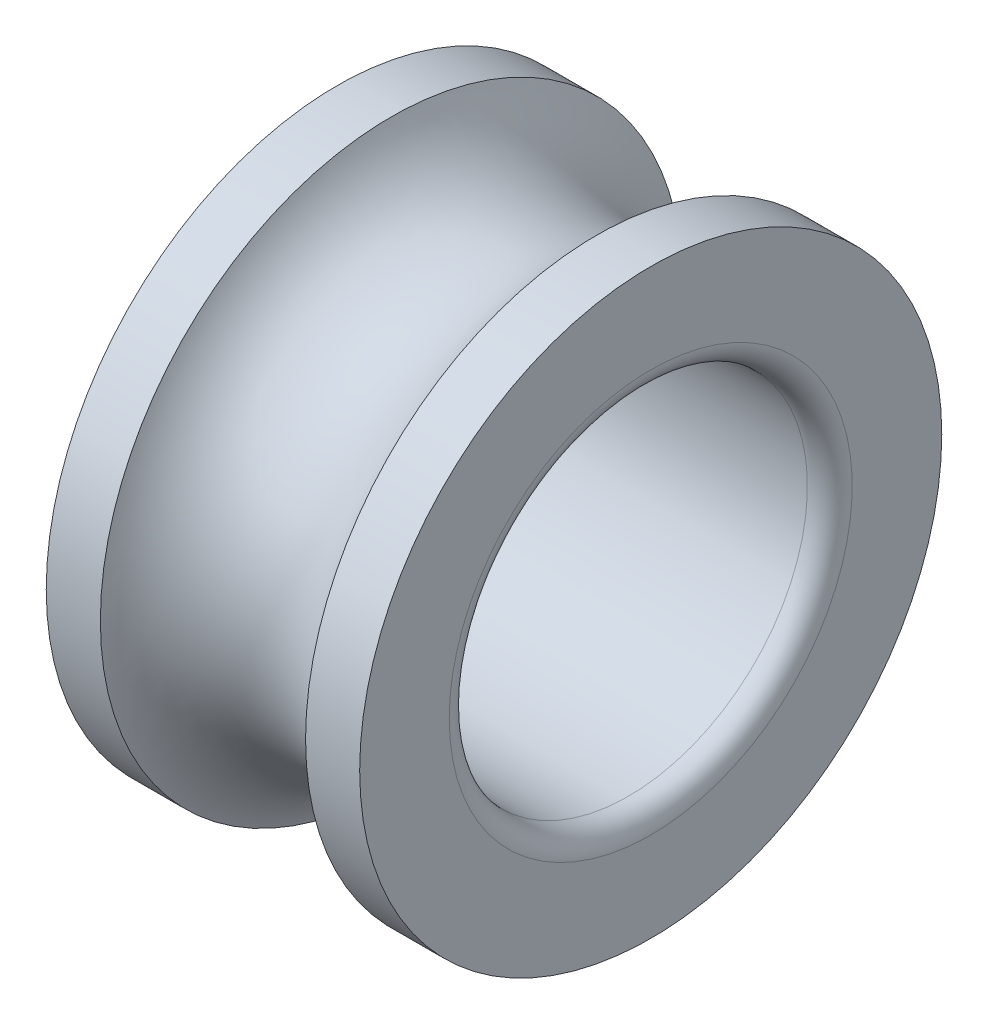
from build123d import *


with BuildPart() as part:
    # Esquisse1 → Révolution1 (revolve)
    with BuildSketch(Plane.XY, mode=Mode.PRIVATE) as r_volution1_sk:
        with BuildLine():
            Line((17.923212734, 6.5), (19.131924887, 6.5))
            Line((19.131924887, 6.5), (19.131924887, 4.5))
            ThreePointArc((19.131924887, 4.5), (18.985478277, 4.146446609), (18.631924887, 4))
            Line((18.631924887, 4), (12.631924887, 4))
            ThreePointArc((12.631924887, 4), (12.278371496, 4.146446609), (12.131924887, 4.5))
            Line((12.131924887, 4.5), (12.131924887, 6.5))
            Line((12.131924887, 6.5), (13.340637039, 6.5))
            ThreePointArc((13.340637039, 6.5), (15.631924887, 5), (17.923212734, 6.5))
        make_face()
    revolve(r_volution1_sk.sketch.rotate(Axis((0, 0, 0), (1, 0, 0)), 90), axis=Axis((0, 0, 0), (1, 0, 0)))


solid = part.part
